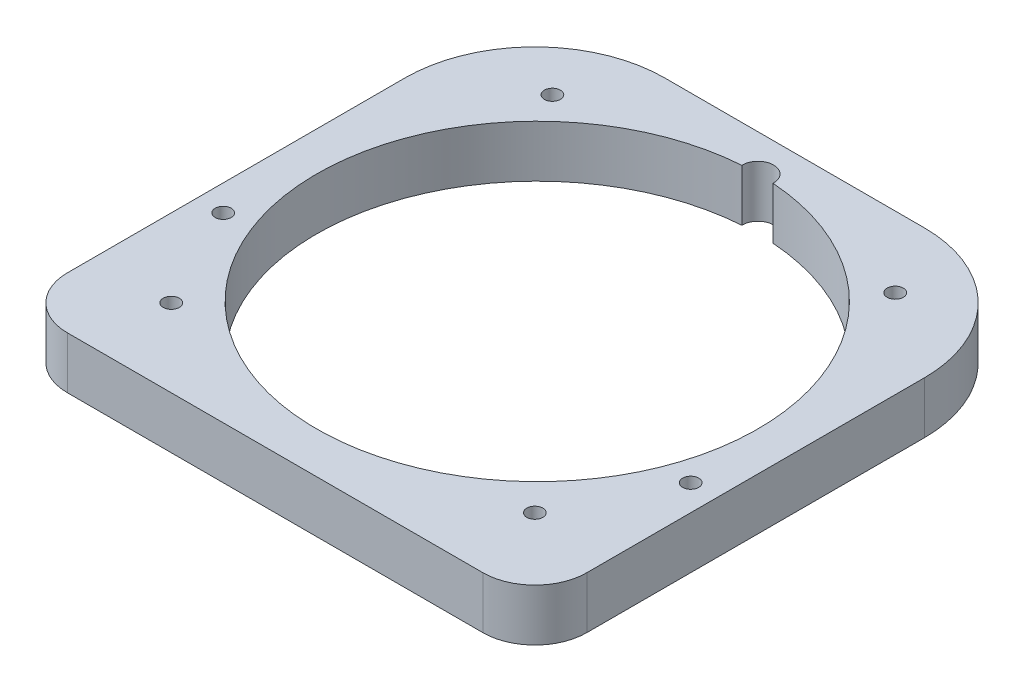
from build123d import *

# Parameters (mm, degrees)
DODANIE_WYCI_GNI_CIE1_DEPTH = 10
WYTNIJ_WYCI_GNI_CIE2_DEPTH  = 142.774468788
SZKIC5_R                    = 1.55
WYTNIJ_WYCI_GNI_CIE3_DEPTH  = 142.774468788


with BuildPart() as part:
    # Szkic1 → Dodanie-wyciągnięcie1 (new body)
    with BuildSketch(Plane(origin=(0, 0, 0), x_dir=(1, 0, 0), z_dir=(0, 1, 0))):
        with BuildLine():
            Line((10, 0), (90, 0))
            ThreePointArc((90, 0), (97.071067812, 2.928932188), (100, 10))
            Line((100, 10), (100, 75))
            ThreePointArc((100, 75), (92.67766953, 92.67766953), (75, 100))
            Line((75, 100), (25, 100))
            ThreePointArc((25, 100), (7.32233047, 92.67766953), (0, 75))
            Line((0, 75), (0, 10))
            ThreePointArc((0, 10), (2.928932188, 2.928932188), (10, 0))
        make_face()
    extrude(amount=-DODANIE_WYCI_GNI_CIE1_DEPTH)

    # Szkic4 → Wytnij-wyciągnięcie2 (cut, through all)
    with BuildSketch(Plane(origin=(0, 0, 0), x_dir=(1, 0, 0), z_dir=(0, 1, 0))):
        with BuildLine():
            ThreePointArc((47.001869094, 92.855975693), (50, 7.961858046), (52.998130906, 92.855975693))
            ThreePointArc((52.998130906, 92.855975693), (50, 95.961858046), (47.001869094, 92.855975693))
        make_face()
    extrude(amount=-WYTNIJ_WYCI_GNI_CIE2_DEPTH, mode=Mode.SUBTRACT)

    # Szkic5 → Wytnij-wyciągnięcie3 (cut, through all)
    with BuildSketch(Plane(origin=(0, 0, 0), x_dir=(1, 0, 0), z_dir=(0, 1, 0))):
        with Locations(Location((83, 86.378345537, 0), (0, 0, 270))):
            Circle(SZKIC5_R)
        with Locations(Location((85, 15, 0), (0, 0, 270))):
            Circle(SZKIC5_R)
        with Locations(Location((5, 35, 0), (0, 0, 270))):
            Circle(SZKIC5_R)
        with Locations(Location((95, 35, 0), (0, 0, 270))):
            Circle(SZKIC5_R)
        with Locations(Location((17, 86.378345537, 0), (0, 0, 270))):
            Circle(SZKIC5_R)
        with Locations(Location((15, 15, 0), (0, 0, 270))):
            Circle(SZKIC5_R)
    extrude(amount=-WYTNIJ_WYCI_GNI_CIE3_DEPTH, mode=Mode.SUBTRACT)


solid = part.part
